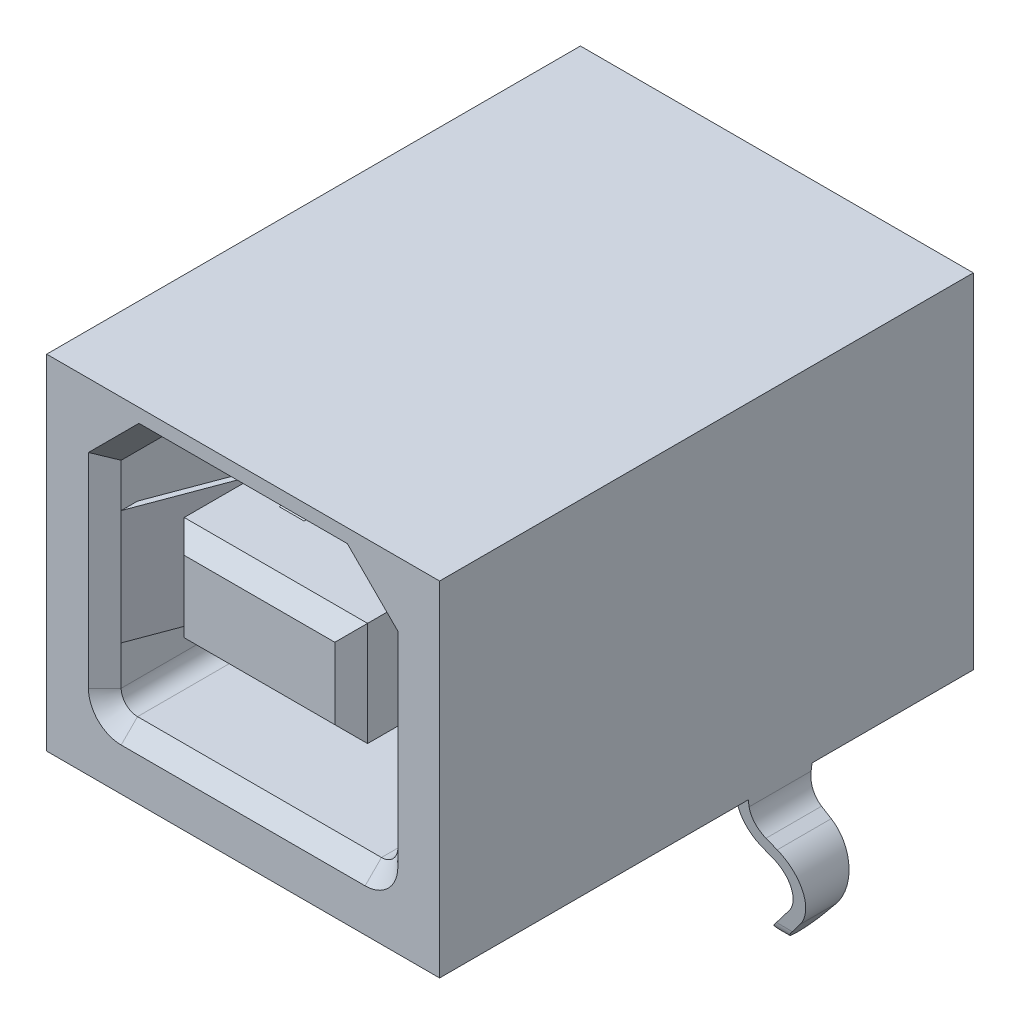
from build123d import *

# Parameters (mm, degrees)
SKETCH1_W                      = 12
SKETCH1_H                      = 10.5
BASE_DEPTH                     = 8.15
CONTACT_OPENING_DEPTH          = 9
CONTACT_OPENING_LEAD_IN_SIZE   = 0.5
SKETCH3_W                      = 5.6
SKETCH3_H                      = 3.18
CONTACT_AREA_DEPTH             = 8.5
CONTACT_AREA_LEAD_IN_SIZE      = 0.5
HOLDING_TINES_DEPTH            = 1.75
CONTACT_DEPTH                  = 0.375
CONTACT_PATTERN_COUNT          = 2
CONTACT_PATTERN_PITCH          = 2.5
TH_GROUND_LEGS_DEPTH           = 0.975
TH_GROUND_LEG_SHAPE_DEPTH      = 15.215776447
TH_GROUND_LEG_SHAPE_DEPTH_BACK = 15.215776447
TH_TAILS_DEPTH                 = 0.125
TH_TAILS_PATTERN_COUNT         = 2
TH_TAILS_PATTERN_PITCH         = 2


with BuildPart() as part:
    # Sketch1 → Base (new, symmetric)
    with BuildSketch(Plane.XY):
        Rectangle(SKETCH1_W, SKETCH1_H)
    extrude(amount=BASE_DEPTH, both=True)

    # Sketch2 → Contact Opening (cut)
    with BuildSketch(Plane.XY.offset(8.15)):
        with BuildLine():
            Line((-2.975, 4.33), (-4.225, 3.08))
            Line((-4.225, 3.08), (-4.225, -2.95))
            ThreePointArc((-4.225, -2.95), (-4.078553391, -3.303553391), (-3.725, -3.45))
            Line((-3.725, -3.45), (3.725, -3.45))
            ThreePointArc((3.725, -3.45), (4.078553391, -3.303553391), (4.225, -2.95))
            Line((4.225, -2.95), (4.225, 3.08))
            Line((4.225, 3.08), (2.975, 4.33))
            Line((2.975, 4.33), (-2.975, 4.33))
        make_face()
    extrude(amount=-CONTACT_OPENING_DEPTH, mode=Mode.SUBTRACT)

    # Contact Opening Lead-in
    contact_opening_lead_in_edges = [part.edges().sort_by_distance(p)[0] for p in [
        (0, 4.33, 8.15),
        (-3.6, 3.705, 8.15),
        (-4.225, 0.065, 8.15),
        (-4.078553391, -3.303553391, 8.15),
        (0, -3.45, 8.15),
        (4.078553391, -3.303553391, 8.15),
        (4.225, 0.065, 8.15),
        (3.6, 3.705, 8.15),
    ]]
    chamfer(contact_opening_lead_in_edges, length=CONTACT_OPENING_LEAD_IN_SIZE)

    # Sketch3 → Contact Area (add)
    with BuildSketch(Plane.XY.offset(-0.85)):
        with Locations((0, 0.44)):
            Rectangle(SKETCH3_W, SKETCH3_H)
    extrude(amount=CONTACT_AREA_DEPTH)

    # Contact Area Lead-in
    contact_area_lead_in_edges = [part.edges().sort_by_distance(p)[0] for p in [
        (-2.8, 0.44, 7.65),
        (0, -1.15, 7.65),
        (2.8, 0.44, 7.65),
        (0, 2.03, 7.65),
    ]]
    chamfer(contact_area_lead_in_edges, length=CONTACT_AREA_LEAD_IN_SIZE)

    # Sketch7 → Holding Tines (add, symmetric)
    with BuildSketch(Plane(origin=(0, 0, 0), x_dir=(1, 0, 0), z_dir=(0, 1, 0))):
        with BuildLine():
            Line((-4.225, -7.65), (-3.215243234, -4.951316752))
            ThreePointArc((-3.215243234, -4.951316752), (-3.027350135, -3.781276433), (-3.307189725, -2.629760924))
            Line((-3.307189725, -2.629760924), (-3.695, -1.8))
            Line((-3.695, -1.8), (-3.853538933, -1.874097279))
            Line((-3.853538933, -1.874097279), (-3.465728658, -2.703858203))
            ThreePointArc((-3.465728658, -2.703858203), (-3.202213044, -3.788201975), (-3.379145712, -4.889989942))
            Line((-3.379145712, -4.889989942), (-4.388902478, -7.588673189))
            Line((-4.388902478, -7.588673189), (-4.225, -7.65))
        make_face()
        with BuildLine():
            Line((4.225, -7.65), (4.388902478, -7.588673189))
            Line((4.388902478, -7.588673189), (3.379145712, -4.889989942))
            ThreePointArc((3.379145712, -4.889989942), (3.202213044, -3.788201975), (3.465728658, -2.703858203))
            Line((3.465728658, -2.703858203), (3.853538933, -1.874097279))
            Line((3.853538933, -1.874097279), (3.695, -1.8))
            Line((3.695, -1.8), (3.307189725, -2.629760924))
            ThreePointArc((3.307189725, -2.629760924), (3.027350135, -3.781276433), (3.215243234, -4.951316752))
            Line((3.215243234, -4.951316752), (4.225, -7.65))
        make_face()
    extrude(amount=HOLDING_TINES_DEPTH, both=True)

    # Sketch8 → Contact (add, symmetric)
    with BuildSketch(Plane(origin=(-1.25, 0, 0), x_dir=(0, 0, -1), z_dir=(1, 0, 0))):
        with BuildLine():
            Line((0.85, 2.03), (-2.595251124, 2.678262825))
            ThreePointArc((-2.595251124, 2.678262825), (-3.47053143, 2.712827451), (-4.318484282, 2.493086043))
            Line((-4.318484282, 2.493086043), (-5.65, 1.93))
            Line((-5.65, 1.93), (-5.581838417, 1.768819981))
            Line((-5.581838417, 1.768819981), (-4.250322699, 2.331906024))
            ThreePointArc((-4.250322699, 2.331906024), (-3.451833763, 2.538829183), (-2.627611475, 2.506280827))
            Line((-2.627611475, 2.506280827), (0.817639649, 1.858018002))
            Line((0.817639649, 1.858018002), (0.85, 2.03))
        make_face()
        with BuildLine():
            Line((-5.581838417, -0.888819981), (-5.65, -1.05))
            Line((-5.65, -1.05), (-4.318484282, -1.613086043))
            ThreePointArc((-4.318484282, -1.613086043), (-3.47053143, -1.832827451), (-2.595251124, -1.798262825))
            Line((-2.595251124, -1.798262825), (0.85, -1.15))
            Line((0.85, -1.15), (0.817639649, -0.978018002))
            Line((0.817639649, -0.978018002), (-2.627611475, -1.626280827))
            ThreePointArc((-2.627611475, -1.626280827), (-3.451833763, -1.658829183), (-4.250322699, -1.451906024))
            Line((-4.250322699, -1.451906024), (-5.581838417, -0.888819981))
        make_face()
    contact = extrude(amount=CONTACT_DEPTH, both=True)

    # Contact Pattern: Contact ×2
    with Locations(*[(i * CONTACT_PATTERN_PITCH, 0, 0) for i in range(1, CONTACT_PATTERN_COUNT)]):
        add(contact)

    # Sketch13 → TH Ground Legs (add, symmetric)
    with BuildSketch(Plane.XY.offset(-2.25)):
        with BuildLine():
            Line((6, -5.25), (6, -5.45))
            ThreePointArc((6, -5.45), (6.112536174, -5.84514538), (6.41637299, -6.121709028))
            Line((6.41637299, -6.121709028), (6.736045017, -6.280484954))
            ThreePointArc((6.736045017, -6.280484954), (7.400291967, -7.129098698), (7.157524757, -8.179066973))
            Line((7.157524757, -8.179066973), (6.527167526, -8.97))
            Line((6.527167526, -8.97), (6.23, -8.73316364))
            Line((6.23, -8.73316364), (6.860357231, -7.942230613))
            ThreePointArc((6.860357231, -7.942230613), (7.029323209, -7.211452694), (6.567007332, -6.620817528))
            Line((6.567007332, -6.620817528), (6.247335304, -6.462041602))
            ThreePointArc((6.247335304, -6.462041602), (5.789554503, -6.045352372), (5.62, -5.45))
            Line((5.62, -5.45), (5.62, -5.25))
            Line((5.62, -5.25), (6, -5.25))
        make_face()
        with BuildLine():
            Line((-5.62, -5.25), (-6, -5.25))
            Line((-6, -5.25), (-6, -5.45))
            ThreePointArc((-6, -5.45), (-6.112536174, -5.84514538), (-6.41637299, -6.121709028))
            Line((-6.41637299, -6.121709028), (-6.736045017, -6.280484954))
            ThreePointArc((-6.736045017, -6.280484954), (-7.400291967, -7.129098698), (-7.157524757, -8.179066973))
            Line((-7.157524757, -8.179066973), (-6.527167526, -8.97))
            Line((-6.527167526, -8.97), (-6.23, -8.73316364))
            Line((-6.23, -8.73316364), (-6.860357231, -7.942230613))
            ThreePointArc((-6.860357231, -7.942230613), (-7.029323209, -7.211452694), (-6.567007332, -6.620817528))
            Line((-6.567007332, -6.620817528), (-6.247335304, -6.462041602))
            ThreePointArc((-6.247335304, -6.462041602), (-5.789554503, -6.045352372), (-5.62, -5.45))
            Line((-5.62, -5.45), (-5.62, -5.25))
        make_face()
    extrude(amount=TH_GROUND_LEGS_DEPTH, both=True)

    # Sketch14 → TH Ground Leg Shape (cut, two sides: drawn at the far end of the back side and taken through both)
    with BuildSketch(Plane(origin=(0, 0, 0), x_dir=(0, 0, -1), z_dir=(1, 0, 0)).offset(-TH_GROUND_LEG_SHAPE_DEPTH_BACK)):
        with BuildLine():
            Line((3.225, -5.25), (3.225, -9))
            Line((3.225, -9), (1.275, -9))
            Line((1.275, -9), (1.275, -5.25))
            Line((1.275, -5.25), (1.755236252, -8.542172253))
            ThreePointArc((1.755236252, -8.542172253), (2.25, -8.97), (2.744763748, -8.542172253))
            Line((2.744763748, -8.542172253), (3.225, -5.25))
        make_face()
    extrude(amount=TH_GROUND_LEG_SHAPE_DEPTH + TH_GROUND_LEG_SHAPE_DEPTH_BACK, mode=Mode.SUBTRACT)

    # Sketch15 → TH Tails (add, symmetric)
    with BuildSketch(Plane(origin=(0, 0, -7.3), x_dir=(-1, 0, 0), z_dir=(0, 0, -1))):
        Polygon((-1.58, -5.25), (-0.92, -5.25), (-0.92, -8.1), (-1.041207868, -8.4), (-1.458792132, -8.4), (-1.58, -8.1), align=None)
        Polygon((0.92, -8.1), (1.041207868, -8.4), (1.458792132, -8.4), (1.58, -8.1), (1.58, -5.25), (0.92, -5.25), align=None)
    th_tails = extrude(amount=TH_TAILS_DEPTH, both=True)

    # TH Tails Pattern: TH Tails ×2
    with Locations(*[(0, 0, i * TH_TAILS_PATTERN_PITCH) for i in range(1, TH_TAILS_PATTERN_COUNT)]):
        add(th_tails)


solid = part.part
